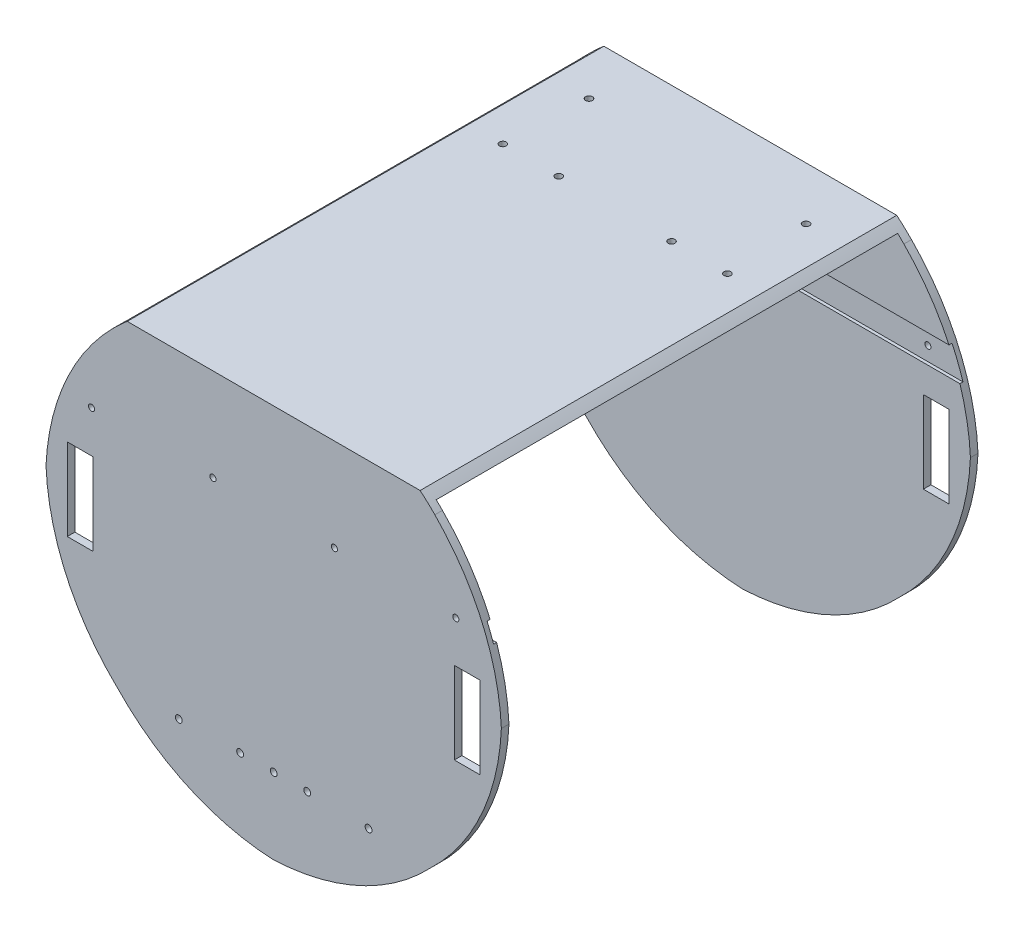
from build123d import *

# Parameters (mm, degrees)
BOSS_EXTRUDE1_DEPTH      = 150
BOSS_EXTRUDE1_DEPTH_BACK = 150
CUT_EXTRUDE1_DEPTH       = 338.979289306
CUT_EXTRUDE1_DEPTH_BACK  = 338.979289306
SKETCH2_OUTSIDE_W        = 403.13
SKETCH2_OUTSIDE_H        = 362.13
CUT_EXTRUDE2_DEPTH       = 338.979289306
CUT_EXTRUDE2_DEPTH_BACK  = 338.979289306
SKETCH3_W                = 4
SKETCH3_H                = 11
SKETCH3_H_2              = 18.5
CUT_EXTRUDE3_DEPTH       = 338.979289306
CUT_EXTRUDE3_DEPTH_BACK  = 338.979289306
SKETCH4_R                = 2
CUT_EXTRUDE4_DEPTH       = 338.979289306
CUT_EXTRUDE4_DEPTH_BACK  = 338.979289306
SKETCH6_W                = 17
SKETCH6_H                = 54
CUT_EXTRUDE5_REACH       = 435.794
SKETCH7_R                = 2.25
CUT_EXTRUDE6_REACH       = 339.979
SKETCH8_R                = 2.25
FILLET1_R                = 1


with BuildPart() as part:
    # Sketch1 → Boss-Extrude1 (new, two sides: drawn at the far end of the back side and taken through both)
    with BuildSketch(Plane(origin=(0, 0, 0), x_dir=(0, 0, -1), z_dir=(1, 0, 0)).offset(-BOSS_EXTRUDE1_DEPTH_BACK)):
        Polygon((-152, 0), (-152, 254), (152, 254), (152, 0), (157, 0), (157, 259), (-157, 259), (-157, 0), align=None)
    extrude(amount=BOSS_EXTRUDE1_DEPTH + BOSS_EXTRUDE1_DEPTH_BACK)

    # Sketch2 outside → Cut-Extrude1 (cut, two sides: drawn at the far end of the back side and taken through both)
    with BuildSketch(Plane.XY.offset(-CUT_EXTRUDE1_DEPTH_BACK)):
        with Locations((0, 129.5)):
            Rectangle(SKETCH2_OUTSIDE_W, SKETCH2_OUTSIDE_H)
        with BuildLine():
            ThreePointArc((-106.180566109, 249.989548857), (-57.545132629, 283.138396945), (0, 295.5))
            ThreePointArc((0, 295.5), (57.545132629, 283.138396945), (106.180566109, 249.989548857))
            ThreePointArc((106.180566109, 249.989548857), (137.347558964, 204.051684319), (150, 150))
            ThreePointArc((150, 150), (136.604447301, 93.873050207), (103.124452968, 46.875547032))
            ThreePointArc((103.124452968, 46.875547032), (56.126949793, 13.395552699), (0, 0))
            ThreePointArc((0, 0), (-56.126949793, 13.395552699), (-103.124452968, 46.875547032))
            ThreePointArc((-103.124452968, 46.875547032), (-136.604447301, 93.873050207), (-150, 150))
            ThreePointArc((-150, 150), (-137.347558964, 204.051684319), (-106.180566109, 249.989548857))
        make_face(mode=Mode.SUBTRACT)
    extrude(amount=CUT_EXTRUDE1_DEPTH + CUT_EXTRUDE1_DEPTH_BACK, mode=Mode.SUBTRACT)

    # Sketch3 → Cut-Extrude2 (cut, two sides: drawn at the far end of the back side and taken through both)
    with BuildSketch(Plane(origin=(0, 0, 0), x_dir=(0, 0, -1), z_dir=(1, 0, 0)).offset(-CUT_EXTRUDE2_DEPTH_BACK)):
        with Locations((-152, 198)):
            Rectangle(SKETCH3_W, SKETCH3_H)
        with Locations((152, 198)):
            Rectangle(SKETCH3_W, SKETCH3_H_2)
    extrude(amount=CUT_EXTRUDE2_DEPTH + CUT_EXTRUDE2_DEPTH_BACK, mode=Mode.SUBTRACT)

    # Sketch4 → Cut-Extrude3 (cut, two sides: drawn at the far end of the back side and taken through both)
    with BuildSketch(Plane.XY.offset(-CUT_EXTRUDE3_DEPTH_BACK)):
        with Locations((-120, 198)):
            Circle(SKETCH4_R)
        with Locations((120, 198)):
            Circle(SKETCH4_R)
        with Locations((40, 198)):
            Circle(SKETCH4_R)
        with Locations((-40, 198)):
            Circle(SKETCH4_R)
    extrude(amount=CUT_EXTRUDE3_DEPTH + CUT_EXTRUDE3_DEPTH_BACK, mode=Mode.SUBTRACT)

    # Sketch6 → Cut-Extrude4 (cut, two sides: drawn at the far end of the back side and taken through both)
    with BuildSketch(Plane.XY.offset(-CUT_EXTRUDE4_DEPTH_BACK)):
        with Locations((-127.5, 143.5)):
            Rectangle(SKETCH6_W, SKETCH6_H)
        with Locations((127.5, 143.5)):
            Rectangle(SKETCH6_W, SKETCH6_H)
    extrude(amount=CUT_EXTRUDE4_DEPTH + CUT_EXTRUDE4_DEPTH_BACK, mode=Mode.SUBTRACT)

    # Sketch7 → Cut-Extrude5 (cut, up to next)
    with BuildSketch(Plane.XY.offset(157), mode=Mode.PRIVATE) as cut_extrude5_sk1:
        with Locations((0, 50)):
            Circle(SKETCH7_R)
    cut_extrude5_tool1 = extrude(cut_extrude5_sk1.sketch, amount=-CUT_EXTRUDE5_REACH, mode=Mode.PRIVATE) & part.part
    # Sketch7 → Cut-Extrude5 (cut, up to next)
    with BuildSketch(Plane.XY.offset(157), mode=Mode.PRIVATE) as cut_extrude5_sk2:
        with Locations((22.11, 50)):
            Circle(SKETCH7_R)
    cut_extrude5_tool2 = extrude(cut_extrude5_sk2.sketch, amount=-CUT_EXTRUDE5_REACH, mode=Mode.PRIVATE) & part.part
    # Sketch7 → Cut-Extrude5 (cut, up to next)
    with BuildSketch(Plane.XY.offset(157), mode=Mode.PRIVATE) as cut_extrude5_sk3:
        with Locations((-22.11, 50)):
            Circle(SKETCH7_R)
    cut_extrude5_tool3 = extrude(cut_extrude5_sk3.sketch, amount=-CUT_EXTRUDE5_REACH, mode=Mode.PRIVATE) & part.part
    # Sketch7 → Cut-Extrude5 (cut, up to next)
    with BuildSketch(Plane.XY.offset(157), mode=Mode.PRIVATE) as cut_extrude5_sk4:
        with Locations((-62.5, 49.15)):
            Circle(SKETCH7_R)
    cut_extrude5_tool4 = extrude(cut_extrude5_sk4.sketch, amount=-CUT_EXTRUDE5_REACH, mode=Mode.PRIVATE) & part.part
    # Sketch7 → Cut-Extrude5 (cut, up to next)
    with BuildSketch(Plane.XY.offset(157), mode=Mode.PRIVATE) as cut_extrude5_sk5:
        with Locations((62.5, 49.15)):
            Circle(SKETCH7_R)
    cut_extrude5_tool5 = extrude(cut_extrude5_sk5.sketch, amount=-CUT_EXTRUDE5_REACH, mode=Mode.PRIVATE) & part.part
    add(cut_extrude5_tool1.solids().sort_by_distance((0, 50, 157))[0], mode=Mode.SUBTRACT)
    add(cut_extrude5_tool2.solids().sort_by_distance((22.11, 50, 157))[0], mode=Mode.SUBTRACT)
    add(cut_extrude5_tool3.solids().sort_by_distance((-22.11, 50, 157))[0], mode=Mode.SUBTRACT)
    add(cut_extrude5_tool4.solids().sort_by_distance((-62.5, 49.15, 157))[0], mode=Mode.SUBTRACT)
    add(cut_extrude5_tool5.solids().sort_by_distance((62.5, 49.15, 157))[0], mode=Mode.SUBTRACT)

    # Sketch8 → Cut-Extrude6 (cut, up to next)
    with BuildSketch(Plane(origin=(0, 259, 0), x_dir=(1, 0, 0), z_dir=(0, 1, 0)), mode=Mode.PRIVATE) as cut_extrude6_sk1:
        with Locations((-73.95, 67.95)):
            Circle(SKETCH8_R)
    cut_extrude6_tool1 = extrude(cut_extrude6_sk1.sketch, amount=-CUT_EXTRUDE6_REACH, mode=Mode.PRIVATE) & part.part
    # Sketch8 → Cut-Extrude6 (cut, up to next)
    with BuildSketch(Plane(origin=(0, 259, 0), x_dir=(1, 0, 0), z_dir=(0, 1, 0)), mode=Mode.PRIVATE) as cut_extrude6_sk2:
        with Locations((73.95, 67.95)):
            Circle(SKETCH8_R)
    cut_extrude6_tool2 = extrude(cut_extrude6_sk2.sketch, amount=-CUT_EXTRUDE6_REACH, mode=Mode.PRIVATE) & part.part
    # Sketch8 → Cut-Extrude6 (cut, up to next)
    with BuildSketch(Plane(origin=(0, 259, 0), x_dir=(1, 0, 0), z_dir=(0, 1, 0)), mode=Mode.PRIVATE) as cut_extrude6_sk3:
        with Locations((37.15, 67.95)):
            Circle(SKETCH8_R)
    cut_extrude6_tool3 = extrude(cut_extrude6_sk3.sketch, amount=-CUT_EXTRUDE6_REACH, mode=Mode.PRIVATE) & part.part
    # Sketch8 → Cut-Extrude6 (cut, up to next)
    with BuildSketch(Plane(origin=(0, 259, 0), x_dir=(1, 0, 0), z_dir=(0, 1, 0)), mode=Mode.PRIVATE) as cut_extrude6_sk4:
        with Locations((-37.15, 67.95)):
            Circle(SKETCH8_R)
    cut_extrude6_tool4 = extrude(cut_extrude6_sk4.sketch, amount=-CUT_EXTRUDE6_REACH, mode=Mode.PRIVATE) & part.part
    # Sketch8 → Cut-Extrude6 (cut, up to next)
    with BuildSketch(Plane(origin=(0, 259, 0), x_dir=(1, 0, 0), z_dir=(0, 1, 0)), mode=Mode.PRIVATE) as cut_extrude6_sk5:
        with Locations((-71.5, 122.23)):
            Circle(SKETCH8_R)
    cut_extrude6_tool5 = extrude(cut_extrude6_sk5.sketch, amount=-CUT_EXTRUDE6_REACH, mode=Mode.PRIVATE) & part.part
    # Sketch8 → Cut-Extrude6 (cut, up to next)
    with BuildSketch(Plane(origin=(0, 259, 0), x_dir=(1, 0, 0), z_dir=(0, 1, 0)), mode=Mode.PRIVATE) as cut_extrude6_sk6:
        with Locations((71.5, 122.23)):
            Circle(SKETCH8_R)
    cut_extrude6_tool6 = extrude(cut_extrude6_sk6.sketch, amount=-CUT_EXTRUDE6_REACH, mode=Mode.PRIVATE) & part.part
    add(cut_extrude6_tool1.solids().sort_by_distance((-73.95, 259, -67.95))[0], mode=Mode.SUBTRACT)
    add(cut_extrude6_tool2.solids().sort_by_distance((73.95, 259, -67.95))[0], mode=Mode.SUBTRACT)
    add(cut_extrude6_tool3.solids().sort_by_distance((37.15, 259, -67.95))[0], mode=Mode.SUBTRACT)
    add(cut_extrude6_tool4.solids().sort_by_distance((-37.15, 259, -67.95))[0], mode=Mode.SUBTRACT)
    add(cut_extrude6_tool5.solids().sort_by_distance((-71.5, 259, -122.23))[0], mode=Mode.SUBTRACT)
    add(cut_extrude6_tool6.solids().sort_by_distance((71.5, 259, -122.23))[0], mode=Mode.SUBTRACT)

    # Fillet1
    fillet1_edges = [part.edges().sort_by_distance(p)[0] for p in [
        (-73.75, 254, -122.23),
        (-76.2, 254, -67.95),
        (-39.4, 254, -67.95),
        (34.9, 254, -67.95),
        (71.7, 254, -67.95),
        (69.25, 254, -122.23),
    ]]
    fillet(fillet1_edges, radius=FILLET1_R)


solid = part.part
